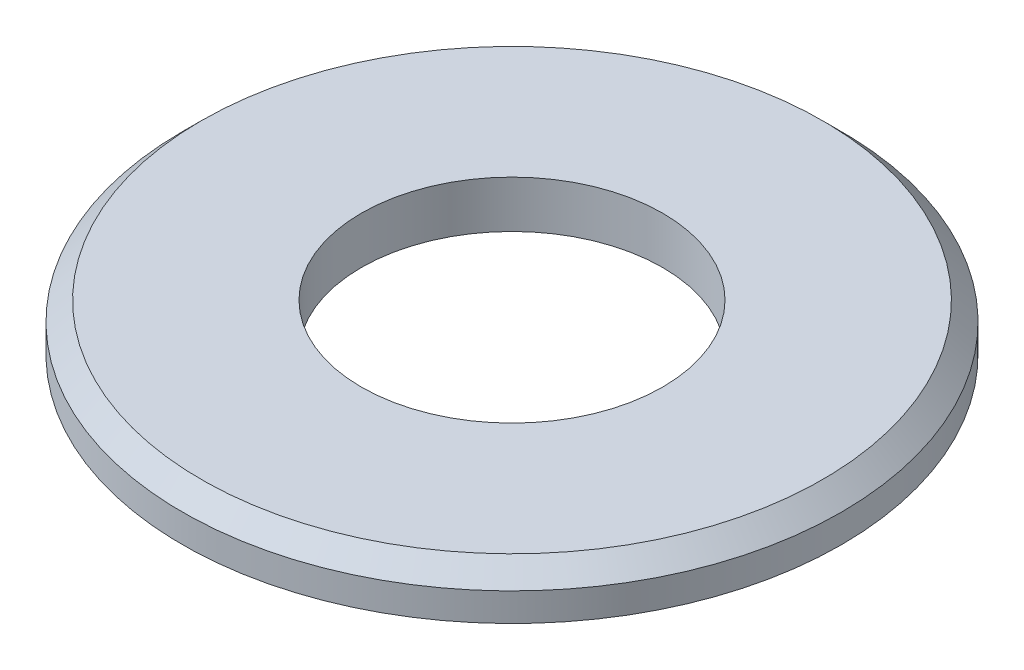
from build123d import *

# Parameters (mm, degrees)
CROQUIS3_R            = 1.6
CORTAR_EXTRUIR1_DEPTH = 5.974937186


with BuildPart() as part:
    # Croquis2 → Revolución1 (revolve)
    with BuildSketch(Plane.XY):
        Polygon((-3.5, 9.995713703), (-3.3, 10.195713703), (0, 10.195713703), (0, 9.695713703), (-3.5, 9.695713703), align=None)
    revolve(axis=Axis((0, 10.195713703, 0), (0, -1, 0)))

    # Croquis3 → Cortar-Extruir1 (cut, through all)
    with BuildSketch(Plane(origin=(0, 10.195713703, 0), x_dir=(1, 0, 0), z_dir=(0, 1, 0))):
        with Locations(Location((0, 0, 0), (0, 0, 180))):
            Circle(CROQUIS3_R)
    extrude(amount=-CORTAR_EXTRUIR1_DEPTH, mode=Mode.SUBTRACT)


solid = part.part
